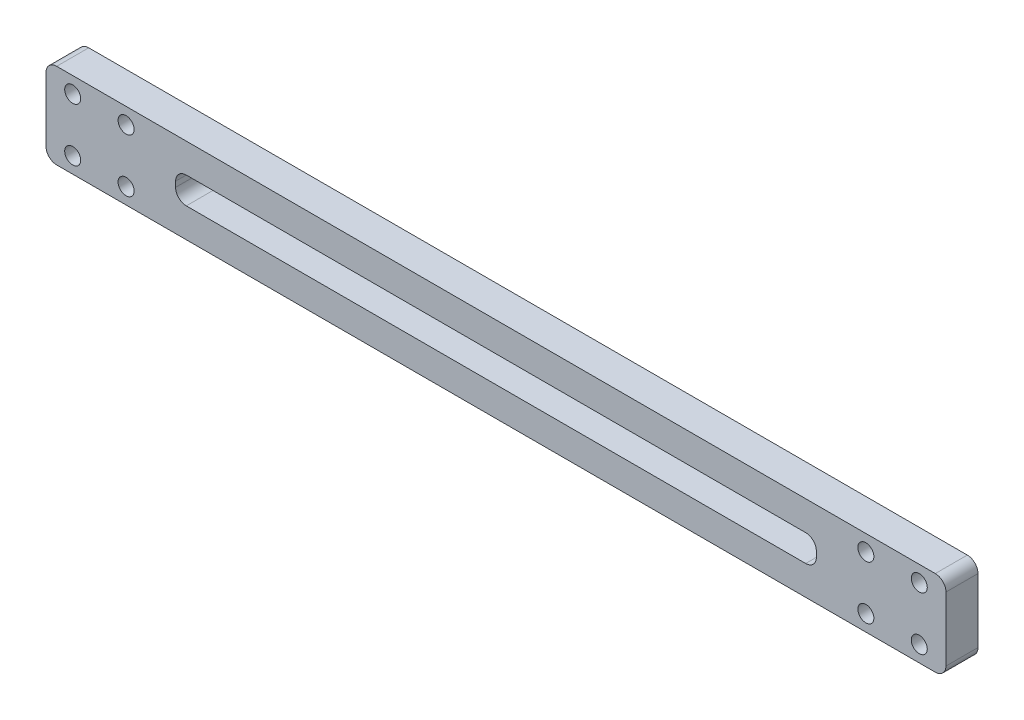
from build123d import *

# Parameters (mm, degrees)
SKETCH_1_W          = 168.54
SKETCH_1_H          = 16
SKETCH_1_R          = 1.5
EXTRUDE_1_DEPTH     = 6
FILLET_1_R          = 2
SKETCH_2_W          = 120
SKETCH_2_H          = 5
CUT_EXTRUDE_1_DEPTH = 6
FILLET_2_R          = 2


with BuildPart() as part:
    # 草图1 → 凸台-拉伸1 (new body)
    with BuildSketch(Plane.XY):
        Rectangle(SKETCH_1_W, SKETCH_1_H)
        with Locations((79.27, 5)):
            Circle(SKETCH_1_R, mode=Mode.SUBTRACT)
        with Locations((69.27, 5)):
            Circle(SKETCH_1_R, mode=Mode.SUBTRACT)
        with Locations((69.27, -5)):
            Circle(SKETCH_1_R, mode=Mode.SUBTRACT)
        with Locations((79.27, -5)):
            Circle(SKETCH_1_R, mode=Mode.SUBTRACT)
        with Locations(Location((-79.27, -5, 0), (0, 0, 180))):
            Circle(SKETCH_1_R, mode=Mode.SUBTRACT)
        with Locations(Location((-69.27, -5, 0), (0, 0, 180))):
            Circle(SKETCH_1_R, mode=Mode.SUBTRACT)
        with Locations(Location((-69.27, 5, 0), (0, 0, 180))):
            Circle(SKETCH_1_R, mode=Mode.SUBTRACT)
        with Locations(Location((-79.27, 5, 0), (0, 0, 180))):
            Circle(SKETCH_1_R, mode=Mode.SUBTRACT)
    extrude(amount=EXTRUDE_1_DEPTH)

    # 圆角1
    fillet_1_edges = [part.edges().sort_by_distance(p)[0] for p in [
        (84.27, -8, 3),
        (-84.27, -8, 3),
        (-84.27, 8, 3),
        (84.27, 8, 3),
    ]]
    fillet(fillet_1_edges, radius=FILLET_1_R)

    # 草图2 → 切除-拉伸1 (cut)
    with BuildSketch(Plane.XY.offset(6)):
        Rectangle(SKETCH_2_W, SKETCH_2_H)
    extrude(amount=-CUT_EXTRUDE_1_DEPTH, mode=Mode.SUBTRACT)

    # 圆角2
    fillet_2_edges = [part.edges().sort_by_distance(p)[0] for p in [
        (60, 2.5, 3),
        (60, -2.5, 3),
        (-60, -2.5, 3),
        (-60, 2.5, 3),
    ]]
    fillet(fillet_2_edges, radius=FILLET_2_R)


solid = part.part
